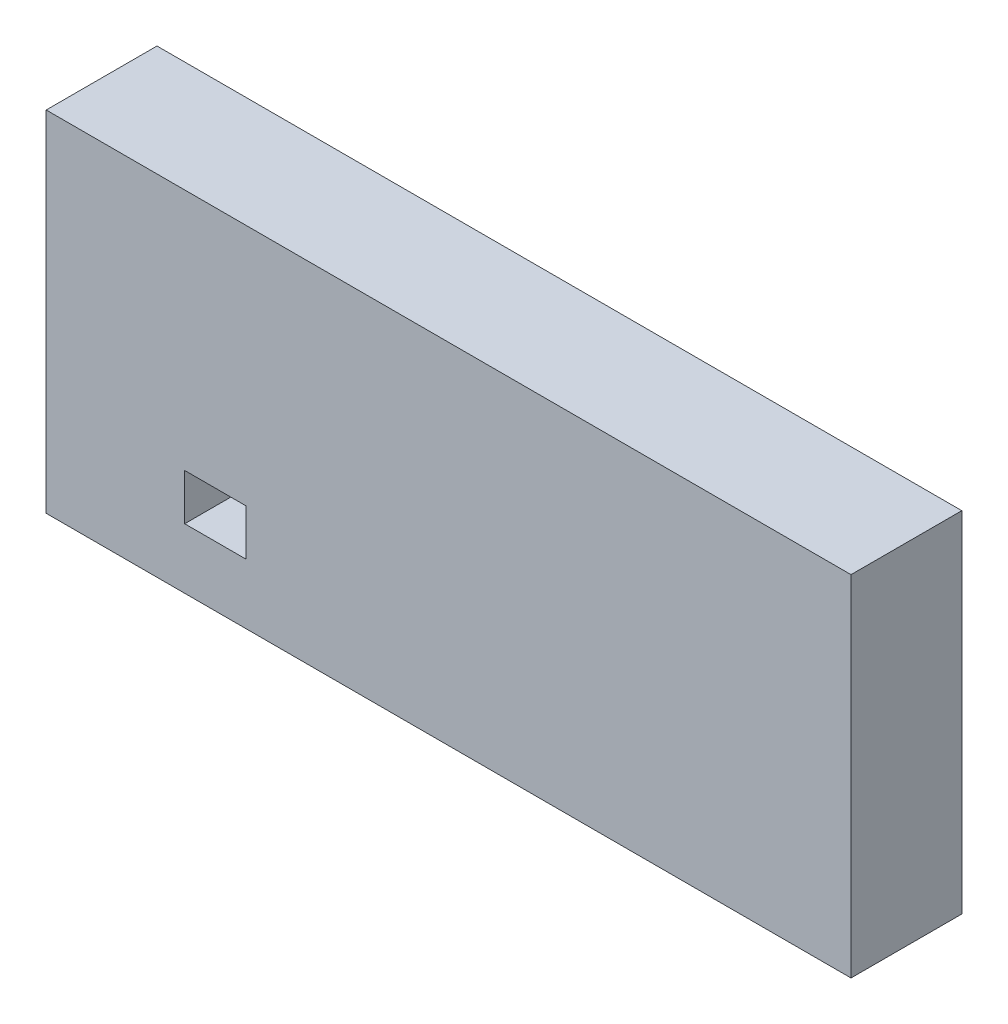
from build123d import *

# Parameters (mm, degrees)
SKETCH_1_W          = 52.3
SKETCH_1_H          = 22.7
EXTRUDE_1_DEPTH     = 7.2
SKETCH_2_W          = 40.6
SKETCH_2_H          = 2.5
EXTRUDE_2_DEPTH     = 2
EXTRUDE_3_DEPTH     = 1
SKETCH_9_W          = 4
SKETCH_9_H          = 3
CUT_EXTRUDE_1_DEPTH = 3.6


with BuildPart() as part:
    # 草图1 → 凸台-拉伸1 (new body)
    with BuildSketch(Plane.XY):
        with Locations((-10.324857143, 4.54)):
            Rectangle(SKETCH_1_W, SKETCH_1_H)
    extrude(amount=EXTRUDE_1_DEPTH)

    # 草图2 → 凸台-拉伸2 (add)
    with BuildSketch(Plane(origin=(0, 0, 0), x_dir=(-1, 0, 0), z_dir=(0, 0, -1))):
        with Locations((10.674857143, -5.56)):
            Rectangle(SKETCH_2_W, SKETCH_2_H)
    extrude(amount=EXTRUDE_2_DEPTH)

    # 草图5 → 凸台-拉伸3 (add)
    with BuildSketch(Plane.ZY.offset(36.474857143)):
        with BuildLine():
            Line((4, 8.54), (4, 0.54))
            ThreePointArc((4, 0.54), (2.5, -0.96), (1, 0.54))
            Line((1, 0.54), (1, 8.54))
            ThreePointArc((1, 8.54), (2.5, 10.04), (4, 8.54))
        make_face()
    extrude(amount=EXTRUDE_3_DEPTH)

    # 草图9 → 切除-拉伸1 (cut)
    with BuildSketch(Plane.XY.offset(7.2)):
        with Locations((-25.474857143, -1.396404092)):
            Rectangle(SKETCH_9_W, SKETCH_9_H)
    extrude(amount=-CUT_EXTRUDE_1_DEPTH, mode=Mode.SUBTRACT)


solid = part.part
